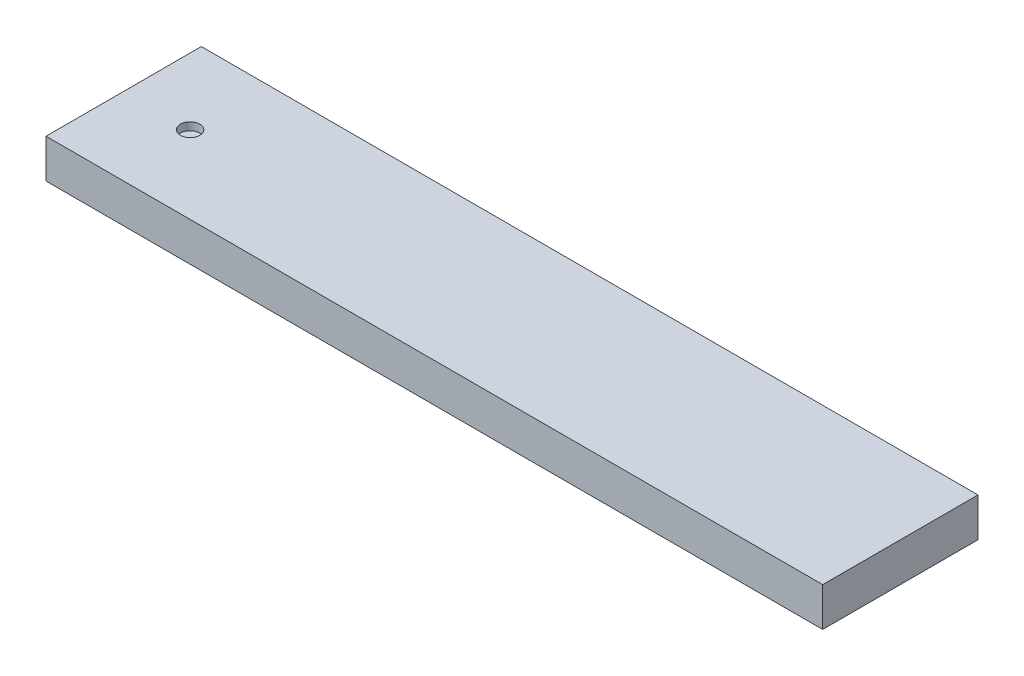
from build123d import *

# Parameters (mm, degrees)
SKETCH1_W           = 254
SKETCH1_H           = 50.8
BOSS_EXTRUDE1_DEPTH = 12.7
SKETCH2_R           = 3.175
CUT_EXTRUDE1_DEPTH  = 2.54


with BuildPart() as part:
    # Sketch1 → Boss-Extrude1 (new body)
    with BuildSketch(Plane(origin=(0, 0, 0), x_dir=(1, 0, 0), z_dir=(0, 1, 0))):
        Rectangle(SKETCH1_W, SKETCH1_H)
    extrude(amount=BOSS_EXTRUDE1_DEPTH)

    # Sketch2 → Cut-Extrude1 (cut)
    with BuildSketch(Plane(origin=(0, 12.7, 0), x_dir=(1, 0, 0), z_dir=(0, 1, 0))):
        with Locations(Location((-105.270556828, 0, 0), (0, 0, 270))):
            Circle(SKETCH2_R)
    extrude(amount=-CUT_EXTRUDE1_DEPTH, mode=Mode.SUBTRACT)


solid = part.part
